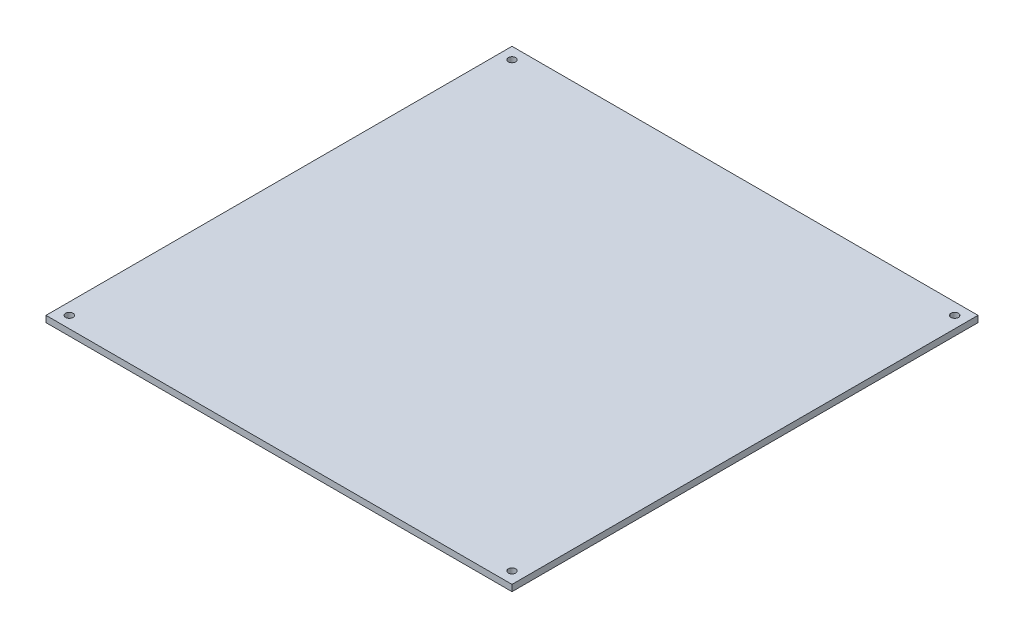
from build123d import *

# Parameters (mm, degrees)
SKETCH1_W           = 220
SKETCH1_H           = 220
SKETCH1_R           = 1.75
BOSS_EXTRUDE1_DEPTH = 3


with BuildPart() as part:
    # Sketch1 → Boss-Extrude1 (new body)
    with BuildSketch(Plane(origin=(0, 0, 0), x_dir=(1, 0, 0), z_dir=(0, 1, 0))):
        with Locations((-110, 110)):
            Rectangle(SKETCH1_W, SKETCH1_H)
        with Locations(Location((-214.5, 214.5, 0), (0, 0, 270))):
            Circle(SKETCH1_R, mode=Mode.SUBTRACT)
        with Locations(Location((-5.5, 214.5, 0), (0, 0, 90))):
            Circle(SKETCH1_R, mode=Mode.SUBTRACT)
        with Locations(Location((-5.5, 5.5, 0), (0, 0, 270))):
            Circle(SKETCH1_R, mode=Mode.SUBTRACT)
        with Locations(Location((-214.5, 5.5, 0), (0, 0, 90))):
            Circle(SKETCH1_R, mode=Mode.SUBTRACT)
    extrude(amount=BOSS_EXTRUDE1_DEPTH)


solid = part.part
